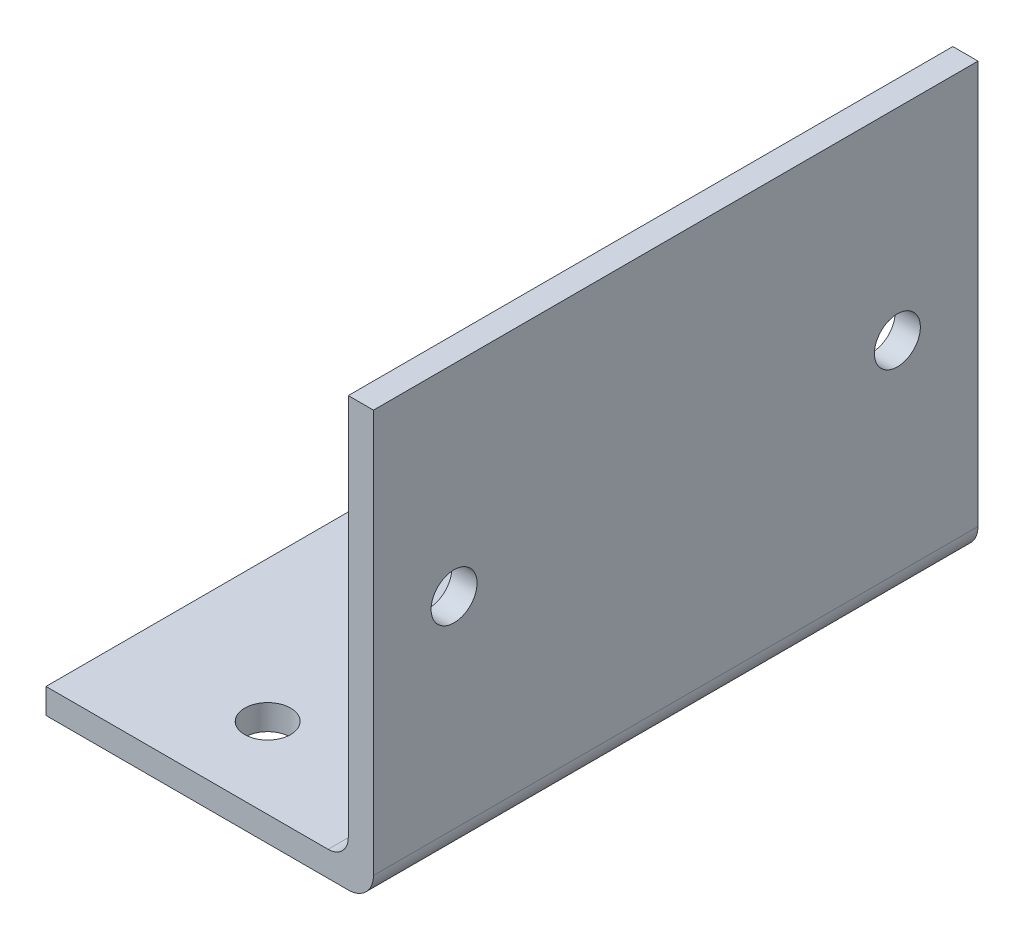
from build123d import *

# Parameters (mm, degrees)
BOSS_EXTRUDE1_DEPTH                  = 76.2
F_12_CLEARANCE_HOLE1_D               = 5.7912
F_12_CLEARANCE_HOLE1_DEPTH           = 68.110147992
F_12_CLEARANCE_HOLE1_TIP             = 1.739852008
F_12_CLEARANCE_HOLE1_ON_FACE_2_D     = 5.7912
F_12_CLEARANCE_HOLE1_ON_FACE_2_DEPTH = 68.110147992
F_12_CLEARANCE_HOLE1_ON_FACE_2_TIP   = 1.739852008


with BuildPart() as part:
    # Sketch1 → Boss-Extrude1 (new body)
    with BuildSketch(Plane.XY):
        with BuildLine():
            Line((0, 0), (38.1, 0))
            ThreePointArc((38.1, 0), (40.34506403, 0.92993597), (41.275, 3.175))
            Line((41.275, 3.175), (41.275, 53.975))
            Line((41.275, 53.975), (38.1, 53.975))
            Line((38.1, 53.975), (38.1, 5.715))
            ThreePointArc((38.1, 5.715), (37.356051224, 3.918948776), (35.56, 3.175))
            Line((35.56, 3.175), (0, 3.175))
            Line((0, 3.175), (0, 0))
        make_face()
    extrude(amount=BOSS_EXTRUDE1_DEPTH)

    # #12 Clearance Hole1
    with Locations(Plane(origin=(41.275, 28.575, 10.16), x_dir=(0, 1, 0), z_dir=(1, 0, 0))):
        with Locations((0, 0), (0, 55.88)):
            Hole(F_12_CLEARANCE_HOLE1_D / 2, depth=F_12_CLEARANCE_HOLE1_DEPTH)
            with Locations((0, 0, -(F_12_CLEARANCE_HOLE1_DEPTH + F_12_CLEARANCE_HOLE1_TIP / 2))):  # 118° drill point
                Cone(0, F_12_CLEARANCE_HOLE1_D / 2, F_12_CLEARANCE_HOLE1_TIP, mode=Mode.SUBTRACT)

    # #12 Clearance Hole1 on face 2
    with Locations(Plane(origin=(17.78, 3.175, 66.04), x_dir=(0, 0, 1), z_dir=(0, 1, 0))):
        with Locations((0, 0), (-55.88, 0)):
            Hole(F_12_CLEARANCE_HOLE1_ON_FACE_2_D / 2, depth=F_12_CLEARANCE_HOLE1_ON_FACE_2_DEPTH)
            with Locations((0, 0, -(F_12_CLEARANCE_HOLE1_ON_FACE_2_DEPTH + F_12_CLEARANCE_HOLE1_ON_FACE_2_TIP / 2))):  # 118° drill point
                Cone(0, F_12_CLEARANCE_HOLE1_ON_FACE_2_D / 2, F_12_CLEARANCE_HOLE1_ON_FACE_2_TIP, mode=Mode.SUBTRACT)


solid = part.part
